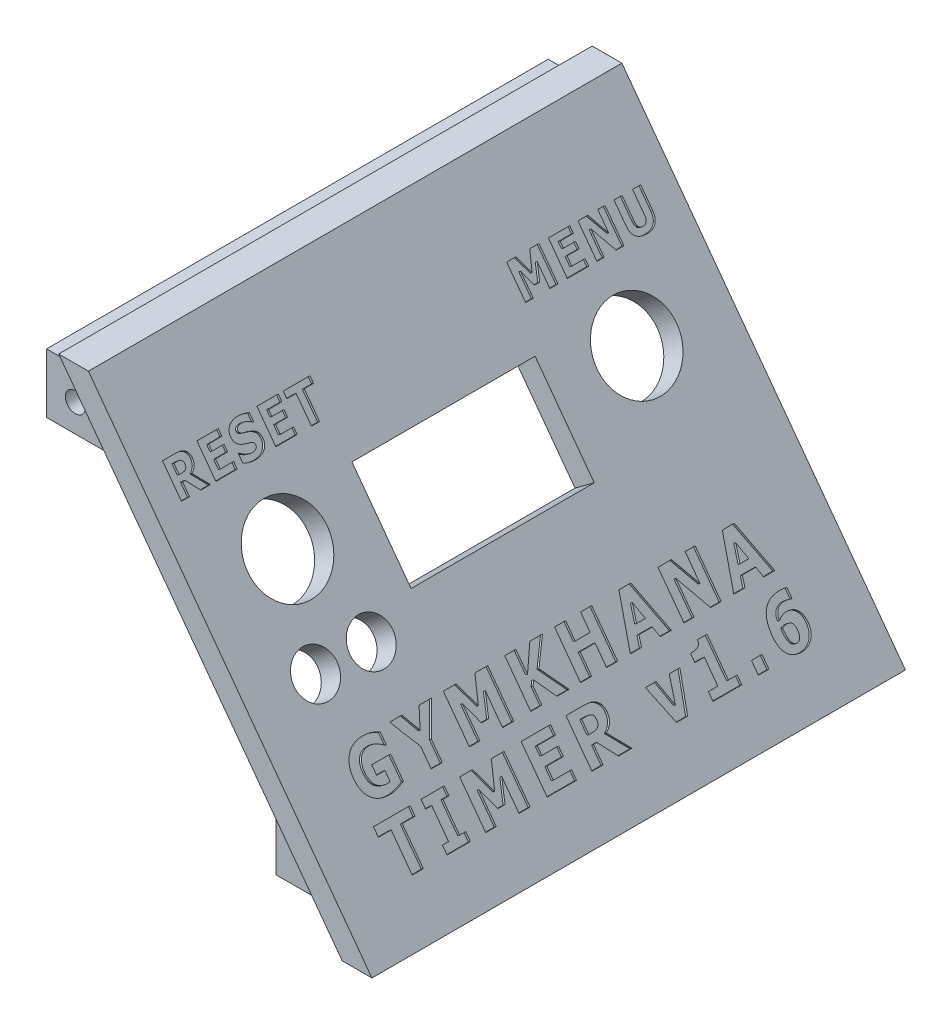
from build123d import *

# Parameters (mm, degrees)
DODANIE_WYCI_GNI_CIE1_DEPTH = 67
SZKIC2_R                    = 3.5
DODANIE_WYCI_GNI_CIE2_DEPTH = 5
SZKIC3_R                    = 1.25
WYTNIJ_WYCI_GNI_CIE1_DEPTH  = 4
SZKIC4_R                    = 5
SZKIC4_R_2                  = 2.7
SZKIC4_W                    = 23
SZKIC4_H                    = 12.5
WYTNIJ_WYCI_GNI_CIE3_DEPTH  = 10
DODANIE_WYCI_GNI_CIE5_DEPTH = 63
DODANIE_WYCI_GNI_CIE6_DEPTH = 10
DODANIE_WYCI_GNI_CIE7_DEPTH = 10
SZKIC10_R                   = 1.25
WYTNIJ_WYCI_GNI_CIE7_DEPTH  = 6
WYTNIJ_WYCI_GNI_CIE8_START  = 6
SZKIC11_R                   = 1.25
WYTNIJ_WYCI_GNI_CIE8_DEPTH  = 6
SZKIC13_R                   = 1.25
WYTNIJ_WYCI_GNI_CIE9_DEPTH  = 6
DODANIE_WYCI_GNI_CIE8_DEPTH = 2
DODANIE_WYCI_GNI_CIE9_DEPTH = 2
WYTNIJ_WYCI_GNI_CIE10_DEPTH = 0.3
SZKIC19_W                   = 1.32278481
SZKIC19_H                   = 1.462025316
WYTNIJ_WYCI_GNI_CIE11_DEPTH = 0.3


with BuildPart() as part:
    # Szkic1 → Dodanie-wyciągnięcie1 (new body)
    with BuildSketch(Plane.XY):
        Polygon((91.551497243, -16.631422451), (55.943641693, 31.568577549), (59.673493323, 31.568577549), (95.281348873, -16.631422451), align=None)
    extrude(amount=DODANIE_WYCI_GNI_CIE1_DEPTH)

    # Szkic2 → Dodanie-wyciągnięcie2 (add)
    with BuildSketch(Plane(origin=(51.279153453, 37.882586906, 0), x_dir=(0, 0, 1), z_dir=(-0.8043215381170195, -0.5941942976174309, 0))):
        with Locations(Location((7.562275383, -20.530690472, 0), (0, 0, 90))):
            Circle(SZKIC2_R)
        with Locations(Location((59.562275523, -20.530690472, 0), (0, 0, 90))):
            Circle(SZKIC2_R)
        with Locations(Location((7.562275383, -51.530691972, 0), (0, 0, 90))):
            Circle(SZKIC2_R)
        with Locations(Location((59.562275523, -51.530691972, 0), (0, 0, 90))):
            Circle(SZKIC2_R)
    extrude(amount=DODANIE_WYCI_GNI_CIE2_DEPTH)

    # Szkic3 → Wytnij-wyciągnięcie1 (cut)
    with BuildSketch(Plane(origin=(47.257545762, 34.911615418, 0), x_dir=(0, 0, 1), z_dir=(-0.8043215381170195, -0.5941942976174309, 0))):
        with Locations(Location((7.562275383, -20.530690472, 0), (0, 0, 270))):
            Circle(SZKIC3_R)
        with Locations(Location((59.562275523, -20.530690472, 0), (0, 0, 270))):
            Circle(SZKIC3_R)
        with Locations(Location((7.562275383, -51.530691972, 0), (0, 0, 270))):
            Circle(SZKIC3_R)
        with Locations(Location((59.562275523, -51.530691972, 0), (0, 0, 270))):
            Circle(SZKIC3_R)
    extrude(amount=-WYTNIJ_WYCI_GNI_CIE1_DEPTH, mode=Mode.SUBTRACT)

    # Szkic4 → Wytnij-wyciągnięcie3 (cut)
    with BuildSketch(Plane(origin=(53.692118067, 39.665169799, 0), x_dir=(0, 0, -1), z_dir=(0.8043215381170198, 0.5941942976174306, 0))):
        with Locations(Location((-55.528674361, -32.847153496, 0), (0, 0, 90))):
            Circle(SZKIC4_R)
        with Locations(Location((-11.595876087, -32.714230134, 0), (0, 0, 90))):
            Circle(SZKIC4_R)
        with Locations(Location((-58.537274149, -43.820748718, 0), (0, 0, 90))):
            Circle(SZKIC4_R_2)
        with Locations(Location((-51.537293222, -43.820729645, 0), (0, 0, 90))):
            Circle(SZKIC4_R_2)
        with Locations((-33.628276354, -35.210709885)):
            Rectangle(SZKIC4_W, SZKIC4_H)
    extrude(amount=-WYTNIJ_WYCI_GNI_CIE3_DEPTH, mode=Mode.SUBTRACT)

    # Szkic5 → Dodanie-wyciągnięcie5 (add)
    with BuildSketch(Plane.XY.offset(2)):
        Polygon((81.232481476, -9.431422451), (81.232481476, -13.431422451), (89.187490236, -13.431422451), (86.232481476, -9.431422451), align=None)
        Polygon((52.421146073, 29.368577549), (57.56889651, 29.368577549), (60.52390527, 25.368577549), (52.421146073, 25.368577549), align=None)
    extrude(amount=DODANIE_WYCI_GNI_CIE5_DEPTH)

    # Szkic8 → Dodanie-wyciągnięcie6 (add)
    with BuildSketch(Plane.XY.offset(2)):
        Polygon((52.421146073, 25.368577549), (52.421146073, 21.902199274), (63.084699811, 21.902199274), (60.52390527, 25.368577549), align=None)
        Polygon((81.232481476, -9.431422451), (86.232481476, -9.431422451), (83.978076817, -6.379783904), (82.475765353, -4.346204194), (81.232481476, -4.346204194), (81.232481476, -6.379783904), align=None)
    extrude(amount=DODANIE_WYCI_GNI_CIE6_DEPTH)

    # Szkic9 → Dodanie-wyciągnięcie7 (add)
    with BuildSketch(Plane(origin=(0, 0, 65), x_dir=(-1, 0, 0), z_dir=(0, 0, -1))):
        Polygon((-52.421146073, 21.902199274), (-52.421146073, 25.368577549), (-60.52390527, 25.368577549), (-63.084699811, 21.902199274), align=None)
        Polygon((-81.232481476, -9.431422451), (-81.232481476, -4.346204194), (-82.475765353, -4.346204194), (-86.232481476, -9.431422451), align=None)
    extrude(amount=DODANIE_WYCI_GNI_CIE7_DEPTH)

    # Szkic10 → Wytnij-wyciągnięcie7 (cut)
    with BuildSketch(Plane(origin=(0, 0, 65), x_dir=(-1, 0, 0), z_dir=(0, 0, -1))):
        with Locations(Location((-56.030137684, 25.368577549, 0), (0, 0, 90))):
            Circle(SZKIC10_R)
    extrude(amount=WYTNIJ_WYCI_GNI_CIE7_DEPTH, mode=Mode.SUBTRACT)

    # Szkic11 → Wytnij-wyciągnięcie8 (cut)
    with BuildSketch(Plane.XY.offset(2).offset(WYTNIJ_WYCI_GNI_CIE8_START)):
        with Locations(Location((56.030137684, 25.368577549, 0), (0, 0, 90))):
            Circle(SZKIC11_R)
    extrude(amount=-WYTNIJ_WYCI_GNI_CIE8_DEPTH, mode=Mode.SUBTRACT)

    # Szkic13 → Wytnij-wyciągnięcie9 (cut)
    with BuildSketch(Plane(origin=(0, -13.631422451, 0), x_dir=(-1, 0, 0), z_dir=(0, -1, 0))):
        with Locations(Location((-83.732481476, -5, 0), (0, 0, 90))):
            Circle(SZKIC13_R)
        with Locations(Location((-83.732481476, -62, 0), (0, 0, 90))):
            Circle(SZKIC13_R)
    extrude(amount=-WYTNIJ_WYCI_GNI_CIE9_DEPTH, mode=Mode.SUBTRACT)

    # Szkic16 → Dodanie-wyciągnięcie8 (add)
    with BuildSketch(Plane(origin=(0, 0, 65), x_dir=(-1, 0, 0), z_dir=(0, 0, -1))):
        Polygon((-82.475765353, -4.346204194), (-81.232481476, -4.346204194), (-61.841415934, 21.902199274), (-63.084699811, 21.902199274), align=None)
    extrude(amount=DODANIE_WYCI_GNI_CIE8_DEPTH)

    # Szkic17 → Dodanie-wyciągnięcie9 (add)
    with BuildSketch(Plane.XY.offset(2)):
        Polygon((61.841415934, 21.902199274), (63.084699811, 21.902199274), (82.475765353, -4.346204194), (81.232481476, -4.346204194), align=None)
    extrude(amount=DODANIE_WYCI_GNI_CIE9_DEPTH)

    # Szkic18 → Wytnij-wyciągnięcie10 (cut)
    # profile 1 of 9: a face of its own
    with BuildSketch(Plane(origin=(53.692118067, 39.665169799, 0), x_dir=(0, 0, -1), z_dir=(0.8043215381170198, 0.5941942976174306, 0))):
        with BuildLine():
            Line((-60.169025405, -24.364973838), (-61.389753253, -24.364973838))
            Line((-61.389753253, -24.364973838), (-62.488645658, -22.896619408))
            Line((-62.488645658, -22.896619408), (-62.801936797, -22.896619408))
            Line((-62.801936797, -22.896619408), (-62.801936797, -24.364973838))
            Line((-62.801936797, -24.364973838), (-63.814595025, -24.364973838))
            Line((-63.814595025, -24.364973838), (-63.814595025, -20.364973838))
            Line((-63.814595025, -20.364973838), (-62.218076038, -20.364973838))
            add(Edge.make_bspline(
                [(-62.218076038, -20.364973838), (-62.164796445, -20.365343537), (-62.061865282, -20.36605776), (-61.912718993, -20.373938315), (-61.774180392, -20.387502755), (-61.644801312, -20.405072534), (-61.522500945, -20.430564335), (-61.406489512, -20.469439473), (-61.294360342, -20.517668573), (-61.224518514, -20.559330975), (-61.189595025, -20.580163712)],
                knots=[0, 0, 0, 0, 1.199793894, 2.317889013, 3.362092139, 4.333845176, 5.257590495, 6.170331022, 7.085098041, 8, 8, 8, 8], degree=3))
            add(Edge.make_bspline(
                [(-61.189595025, -20.580163712), (-61.155171977, -20.603565792), (-61.087212134, -20.649767442), (-60.997458333, -20.733702774), (-60.91767859, -20.825700418), (-60.849010772, -20.927853406), (-60.791886119, -21.041396579), (-60.754173705, -21.170254033), (-60.729979722, -21.312371846), (-60.72735241, -21.412069745), (-60.72598743, -21.463866244)],
                knots=[0, 0, 0, 0, 0.953924463, 1.883289238, 2.810108911, 3.743307755, 4.701369409, 5.714009315, 6.812348952, 8, 8, 8, 8], degree=3))
            add(Edge.make_bspline(
                [(-60.72598743, -21.463866244), (-60.726464911, -21.501344225), (-60.727398254, -21.574603309), (-60.738473162, -21.681525203), (-60.753553708, -21.783214654), (-60.776628975, -21.879556045), (-60.806732274, -21.970136575), (-60.842348621, -22.05589459), (-60.885102475, -22.13585551), (-60.950991436, -22.234950432), (-61.046284525, -22.349189887), (-61.179093354, -22.470570768), (-61.32850617, -22.579192397), (-61.43928278, -22.636424873), (-61.495765911, -22.66560675)],
                knots=[0, 0, 0, 0, 0.888936574, 1.737625011, 2.548320823, 3.326937543, 4.084834997, 4.811205944, 5.527889522, 6.232533624, 7.632244915, 9.044932759, 10.493260882, 12, 12, 12, 12], degree=3))
            Line((-61.495765911, -22.66560675), (-60.169025405, -24.364973838))
        make_face()
        with BuildLine():
            add(Edge.make_bspline(
                [(-61.738645658, -21.579372573), (-61.739037975, -21.554261975), (-61.739797947, -21.505619365), (-61.751804553, -21.435507201), (-61.768154135, -21.370184023), (-61.794264471, -21.311122554), (-61.826416091, -21.256504575), (-61.870006825, -21.209842628), (-61.92266222, -21.169133921), (-61.962932551, -21.148605011), (-61.983898823, -21.137916876)],
                knots=[0, 0, 0, 0, 1.119761289, 2.169128442, 3.168954851, 4.118408773, 5.043447249, 5.985348535, 6.951095516, 8, 8, 8, 8], degree=3))
            add(Edge.make_bspline(
                [(-61.983898823, -21.137916876), (-62.016265628, -21.125434016), (-62.08293326, -21.099722403), (-62.173845648, -21.085413518), (-62.252582417, -21.080022193), (-62.319545142, -21.075435683), (-62.393444683, -21.074574563), (-62.445134323, -21.07408786), (-62.472031734, -21.073834598)],
                knots=[0, 0, 0, 0, 1.256441546, 2.587959541, 3.317795867, 4.123378269, 5.023474215, 6, 6, 6, 6], degree=3))
            Line((-62.472031734, -21.073834598), (-62.801936797, -21.073834598))
            Line((-62.801936797, -21.073834598), (-62.801936797, -22.187758649))
            Line((-62.801936797, -22.187758649), (-62.519500088, -22.187758649))
            add(Edge.make_bspline(
                [(-62.519500088, -22.187758649), (-62.486533226, -22.187449017), (-62.423199484, -22.186854175), (-62.331806917, -22.182513883), (-62.248497023, -22.173346564), (-62.171770563, -22.163234441), (-62.101737636, -22.146111603), (-62.037627322, -22.12103201), (-61.978083612, -22.089907099), (-61.943422576, -22.062285986), (-61.926145658, -22.048518142)],
                knots=[0, 0, 0, 0, 1.270824428, 2.441423287, 3.524730841, 4.500863784, 5.422940595, 6.295084937, 7.15017896, 8, 8, 8, 8], degree=3))
            add(Edge.make_bspline(
                [(-61.926145658, -22.048518142), (-61.911028424, -22.035430365), (-61.880909019, -22.009354426), (-61.842401265, -21.964286582), (-61.810377352, -21.915166077), (-61.783663774, -21.861984358), (-61.762789493, -21.802539837), (-61.749089508, -21.735218512), (-61.740405919, -21.660031551), (-61.739250528, -21.607089038), (-61.738645658, -21.579372573)],
                knots=[0, 0, 0, 0, 0.914359853, 1.821760216, 2.702345359, 3.593131941, 4.539985656, 5.57704332, 6.731533712, 8, 8, 8, 8], degree=3))
        make_face(mode=Mode.SUBTRACT)
    # profile 2 of 9: a face of its own
    with BuildSketch(Plane(origin=(53.692118067, 39.665169799, 0), x_dir=(0, 0, -1), z_dir=(0.8043215381170198, 0.5941942976174306, 0))):
        Polygon((-59.490544392, -24.364973838), (-59.490544392, -20.364973838), (-56.807000088, -20.364973838), (-56.807000088, -21.124467509), (-58.477886164, -21.124467509), (-58.477886164, -21.833328269), (-56.958898823, -21.833328269), (-56.958898823, -22.59282194), (-58.477886164, -22.59282194), (-58.477886164, -23.605480168), (-56.807000088, -23.605480168), (-56.807000088, -24.364973838), align=None)
    # profile 3 of 9: a face of its own
    with BuildSketch(Plane(origin=(53.692118067, 39.665169799, 0), x_dir=(0, 0, -1), z_dir=(0.8043215381170198, 0.5941942976174306, 0))):
        with BuildLine():
            add(Edge.make_bspline(
                [(-54.546240595, -24.466239661), (-54.619324689, -24.465259645), (-54.760946104, -24.463360581), (-54.966738016, -24.446377486), (-55.159011531, -24.419517885), (-55.338701793, -24.379959251), (-55.5077699, -24.331836275), (-55.669767454, -24.278200727), (-55.826332659, -24.221600191), (-55.926991508, -24.177738597), (-55.976620342, -24.156113079)],
                knots=[0, 0, 0, 0, 1.188587951, 2.303230391, 3.356350567, 4.344124042, 5.293358606, 6.214416522, 7.119636025, 8, 8, 8, 8], degree=3))
            Line((-55.976620342, -24.156113079), (-55.976620342, -23.200416876))
            Line((-55.976620342, -23.200416876), (-55.886430468, -23.200416876))
            add(Edge.make_bspline(
                [(-55.886430468, -23.200416876), (-55.836550026, -23.243561879), (-55.737782442, -23.328992709), (-55.577269894, -23.439730554), (-55.410245133, -23.53604222), (-55.2365475, -23.615352917), (-55.060941782, -23.678850013), (-54.885624169, -23.722675364), (-54.713409345, -23.752665903), (-54.598840578, -23.755821282), (-54.542284899, -23.757378902)],
                knots=[0, 0, 0, 0, 1.064005933, 2.106823643, 3.142324773, 4.172904671, 5.185521809, 6.151983196, 7.087745727, 8, 8, 8, 8], degree=3))
            add(Edge.make_bspline(
                [(-54.542284899, -23.757378902), (-54.526983101, -23.756983588), (-54.49422939, -23.756137415), (-54.441730693, -23.751858927), (-54.382652622, -23.745456989), (-54.318689757, -23.737273446), (-54.25472317, -23.725958525), (-54.195134285, -23.711983433), (-54.142400456, -23.69510788), (-54.110973441, -23.679922363), (-54.096082367, -23.672727003)],
                knots=[0, 0, 0, 0, 0.803171281, 1.719199296, 2.763054104, 3.921781135, 5.102693432, 6.170135007, 7.132954358, 8, 8, 8, 8], degree=3))
            add(Edge.make_bspline(
                [(-54.096082367, -23.672727003), (-54.079260425, -23.663855653), (-54.045859583, -23.646241124), (-53.999763548, -23.6136797), (-53.958507287, -23.575634944), (-53.919660884, -23.534440713), (-53.888545071, -23.485187085), (-53.864961384, -23.429268786), (-53.852961415, -23.36546938), (-53.85104133, -23.320975551), (-53.850038063, -23.297727003)],
                knots=[0, 0, 0, 0, 0.958250464, 1.902656275, 2.834625234, 3.785374419, 4.748042504, 5.755488648, 6.827216455, 8, 8, 8, 8], degree=3))
            add(Edge.make_bspline(
                [(-53.850038063, -23.297727003), (-53.851255739, -23.273288679), (-53.853627288, -23.225692519), (-53.87663667, -23.158123931), (-53.915383975, -23.098857187), (-53.967423904, -23.047696814), (-54.029493373, -23.005003057), (-54.095971968, -22.964734274), (-54.170111354, -22.934782493), (-54.22175592, -22.918916624), (-54.247981101, -22.910859914)],
                knots=[0, 0, 0, 0, 0.976980105, 1.90276968, 2.820378867, 3.79191295, 4.806747273, 5.83454199, 6.900377446, 8, 8, 8, 8], degree=3))
            add(Edge.make_bspline(
                [(-54.247981101, -22.910859914), (-54.318023295, -22.892735796), (-54.462151853, -22.855441089), (-54.682439919, -22.807723559), (-54.902565623, -22.756915502), (-55.044419675, -22.710404522), (-55.11348743, -22.687758649)],
                knots=[0, 0, 0, 0, 0.970778871, 1.997609583, 3.025049981, 4, 4, 4, 4], degree=3))
            add(Edge.make_bspline(
                [(-55.11348743, -22.687758649), (-55.150844706, -22.673680369), (-55.22344015, -22.646322407), (-55.326938441, -22.599160319), (-55.422345002, -22.549191552), (-55.50947787, -22.494787197), (-55.588504666, -22.437427678), (-55.659648406, -22.376214212), (-55.722135542, -22.311115885), (-55.777779388, -22.242802284), (-55.823987651, -22.16902792), (-55.865766067, -22.092562064), (-55.899635173, -22.010675209), (-55.928394331, -21.924908974), (-55.949192938, -21.83416332), (-55.965298795, -21.73965125), (-55.974879408, -21.640487586), (-55.976031818, -21.572800424), (-55.976620342, -21.538233332)],
                knots=[0, 0, 0, 0, 1.232734205, 2.395541005, 3.510463934, 4.556875624, 5.565319495, 6.523880384, 7.451310254, 8.349375782, 9.239576409, 10.136015274, 11.0376197, 11.972601359, 12.926826808, 13.909683999, 14.932498543, 16, 16, 16, 16], degree=3))
            add(Edge.make_bspline(
                [(-55.976620342, -21.538233332), (-55.975361565, -21.491992579), (-55.972886395, -21.401068053), (-55.950069685, -21.267954088), (-55.912837831, -21.141579008), (-55.861221323, -21.021738504), (-55.793862573, -20.909248282), (-55.711863704, -20.803732906), (-55.615108512, -20.704920211), (-55.504609443, -20.614153184), (-55.383663346, -20.531187225), (-55.253193973, -20.460502207), (-55.116493881, -20.398842542), (-54.972212609, -20.348972041), (-54.820102147, -20.311331533), (-54.6612385, -20.283757899), (-54.494923941, -20.266710201), (-54.381724821, -20.264722729), (-54.323930468, -20.263708016)],
                knots=[0, 0, 0, 0, 0.951733787, 1.8714216, 2.771937187, 3.659834458, 4.551246461, 5.464900409, 6.405895824, 7.393377429, 8.405714223, 9.421759516, 10.445282372, 11.49132611, 12.560961497, 13.669079994, 14.809937645, 16, 16, 16, 16], degree=3))
            add(Edge.make_bspline(
                [(-54.323930468, -20.263708016), (-54.264833186, -20.264678032), (-54.146489923, -20.266620504), (-53.969594869, -20.280570168), (-53.793133795, -20.302429913), (-53.619051722, -20.334332079), (-53.449228603, -20.372525307), (-53.287089853, -20.417569793), (-53.133858439, -20.468340458), (-53.036783419, -20.508894194), (-52.98927857, -20.528739661)],
                knots=[0, 0, 0, 0, 1.035526462, 2.073658467, 3.107699001, 4.15013179, 5.173679131, 6.156969703, 7.09809057, 8, 8, 8, 8], degree=3))
            Line((-52.98927857, -20.528739661), (-52.98927857, -21.428264978))
            Line((-52.98927857, -21.428264978), (-53.077886164, -21.428264978))
            add(Edge.make_bspline(
                [(-53.077886164, -21.428264978), (-53.116369058, -21.396934014), (-53.194926254, -21.332976436), (-53.325713374, -21.249191114), (-53.467663404, -21.171150034), (-53.620283402, -21.102695183), (-53.779717534, -21.04409924), (-53.943980471, -21.003723513), (-54.110215356, -20.97663413), (-54.222030988, -20.973925599), (-54.278044392, -20.972568775)],
                knots=[0, 0, 0, 0, 0.909132475, 1.855860894, 2.842486714, 3.876811078, 4.919788485, 5.951669293, 6.973900401, 8, 8, 8, 8], degree=3))
            add(Edge.make_bspline(
                [(-54.278044392, -20.972568775), (-54.319499997, -20.973280404), (-54.398531673, -20.974637065), (-54.513725264, -20.990566743), (-54.625504311, -21.0216608), (-54.696444696, -21.054301039), (-54.733740595, -21.07146118)],
                knots=[0, 0, 0, 0, 1.055808145, 2.01281076, 2.955263502, 4, 4, 4, 4], degree=3))
            add(Edge.make_bspline(
                [(-54.733740595, -21.07146118), (-54.749010424, -21.079784416), (-54.779674534, -21.096498724), (-54.822016152, -21.128965296), (-54.861237119, -21.166696944), (-54.896885615, -21.209387006), (-54.927317375, -21.255864098), (-54.947541684, -21.307131995), (-54.962224017, -21.360198172), (-54.963379829, -21.397044183), (-54.963962114, -21.41560675)],
                knots=[0, 0, 0, 0, 0.957416142, 1.922635494, 2.930164298, 3.951958416, 4.984347753, 5.975062963, 6.979861616, 8, 8, 8, 8], degree=3))
            add(Edge.make_bspline(
                [(-54.963962114, -21.41560675), (-54.962569202, -21.440262215), (-54.959884024, -21.487791657), (-54.939862729, -21.555544325), (-54.904700166, -21.614585859), (-54.864615289, -21.656932587), (-54.824340542, -21.686010458), (-54.787923211, -21.70812959), (-54.74480898, -21.729600347), (-54.695215156, -21.749292166), (-54.640158505, -21.77058578), (-54.578496913, -21.789948018), (-54.510326949, -21.808821305), (-54.462671056, -21.820774563), (-54.437854519, -21.826999155)],
                knots=[0, 0, 0, 0, 1.214264784, 2.34079248, 3.441844924, 4.572488008, 5.185916398, 5.885766898, 6.670379076, 7.556104553, 8.514370256, 9.57884454, 10.739196989, 12, 12, 12, 12], degree=3))
            add(Edge.make_bspline(
                [(-54.437854519, -21.826999155), (-54.372164623, -21.84193036), (-54.243289013, -21.871223573), (-54.050165256, -21.916962088), (-53.85328916, -21.967452646), (-53.722621592, -22.012966964), (-53.654626671, -22.036651054)],
                knots=[0, 0, 0, 0, 0.996266869, 1.954554799, 2.935620461, 4, 4, 4, 4], degree=3))
            add(Edge.make_bspline(
                [(-53.654626671, -22.036651054), (-53.620935175, -22.049363765), (-53.555107254, -22.074202417), (-53.461940498, -22.118565733), (-53.374317577, -22.16371559), (-53.294299626, -22.21401985), (-53.220472184, -22.267002148), (-53.152967873, -22.322983891), (-53.09262252, -22.38275947), (-53.038035101, -22.445544305), (-52.990501444, -22.513210521), (-52.94896877, -22.585309751), (-52.915106453, -22.663026432), (-52.886385201, -22.745447977), (-52.864481284, -22.833395864), (-52.84871767, -22.92648242), (-52.8391084, -23.024581531), (-52.837964235, -23.091745042), (-52.837379835, -23.126049788)],
                knots=[0, 0, 0, 0, 1.17454689, 2.294881178, 3.365011102, 4.38938974, 5.375760562, 6.328835541, 7.247690706, 8.144686596, 9.040029798, 9.941965584, 10.855040075, 11.802113214, 12.787244475, 13.808691087, 14.880756899, 16, 16, 16, 16], degree=3))
            add(Edge.make_bspline(
                [(-52.837379835, -23.126049788), (-52.838704625, -23.175177416), (-52.841303196, -23.27154106), (-52.863016499, -23.412545081), (-52.899379335, -23.546068511), (-52.950415508, -23.672212932), (-53.015844527, -23.79083342), (-53.095295659, -23.90249798), (-53.190572419, -24.005587855), (-53.298767613, -24.100948628), (-53.418846637, -24.187262957), (-53.550356694, -24.261747127), (-53.691662028, -24.324910189), (-53.842929249, -24.377564465), (-54.004536893, -24.417520657), (-54.176256603, -24.445525745), (-54.357830198, -24.463500312), (-54.482377867, -24.465311144), (-54.546240595, -24.466239661)],
                knots=[0, 0, 0, 0, 0.965575501, 1.893972421, 2.797150248, 3.681070906, 4.56293602, 5.455031491, 6.368877871, 7.316649527, 8.286503653, 9.271159268, 10.283057314, 11.32599161, 12.416327018, 13.55177918, 14.744656859, 16, 16, 16, 16], degree=3))
        make_face()
    # profile 4 of 9: a face of its own
    with BuildSketch(Plane(origin=(53.692118067, 39.665169799, 0), x_dir=(0, 0, -1), z_dir=(0.8043215381170198, 0.5941942976174306, 0))):
        Polygon((-51.956367177, -24.364973838), (-51.956367177, -20.364973838), (-49.272822873, -20.364973838), (-49.272822873, -21.124467509), (-50.943708949, -21.124467509), (-50.943708949, -21.833328269), (-49.424721607, -21.833328269), (-49.424721607, -22.59282194), (-50.943708949, -22.59282194), (-50.943708949, -23.605480168), (-49.272822873, -23.605480168), (-49.272822873, -24.364973838), align=None)
    # profile 5 of 9: a face of its own
    with BuildSketch(Plane(origin=(53.692118067, 39.665169799, 0), x_dir=(0, 0, -1), z_dir=(0.8043215381170198, 0.5941942976174306, 0))):
        Polygon((-47.48041781, -24.364973838), (-47.48041781, -21.124467509), (-48.644974772, -21.124467509), (-48.644974772, -20.364973838), (-45.30320262, -20.364973838), (-45.30320262, -21.124467509), (-46.467759582, -21.124467509), (-46.467759582, -24.364973838), align=None)
    # profile 6 of 9: a face of its own
    with BuildSketch(Plane(origin=(53.692118067, 39.665169799, 0), x_dir=(0, 0, -1), z_dir=(0.8043215381170198, 0.5941942976174306, 0))):
        Polygon((-16.533582367, -24.364973838), (-17.546240595, -24.364973838), (-17.546240595, -21.703581433), (-18.251936797, -23.402948522), (-18.916493759, -23.402948522), (-19.622189962, -21.703581433), (-19.622189962, -24.364973838), (-20.584215278, -24.364973838), (-20.584215278, -20.364973838), (-19.416493759, -20.364973838), (-18.556525405, -22.325416876), (-17.699721607, -20.364973838), (-16.533582367, -20.364973838), align=None)
    # profile 7 of 9: a face of its own
    with BuildSketch(Plane(origin=(53.692118067, 39.665169799, 0), x_dir=(0, 0, -1), z_dir=(0.8043215381170198, 0.5941942976174306, 0))):
        Polygon((-15.34877224, -24.364973838), (-15.34877224, -20.364973838), (-12.665227937, -20.364973838), (-12.665227937, -21.124467509), (-14.336114013, -21.124467509), (-14.336114013, -21.833328269), (-12.817126671, -21.833328269), (-12.817126671, -22.59282194), (-14.336114013, -22.59282194), (-14.336114013, -23.605480168), (-12.665227937, -23.605480168), (-12.665227937, -24.364973838), align=None)
    # profile 8 of 9: a face of its own
    with BuildSketch(Plane(origin=(53.692118067, 39.665169799, 0), x_dir=(0, 0, -1), z_dir=(0.8043215381170198, 0.5941942976174306, 0))):
        Polygon((-8.239911481, -24.364973838), (-9.19877224, -24.364973838), (-10.720924139, -21.576208016), (-10.720924139, -24.364973838), (-11.632316544, -24.364973838), (-11.632316544, -20.364973838), (-10.410797557, -20.364973838), (-9.151303886, -22.656113079), (-9.151303886, -20.364973838), (-8.239911481, -20.364973838), align=None)
    # profile 9 of 9: a face of its own
    with BuildSketch(Plane(origin=(53.692118067, 39.665169799, 0), x_dir=(0, 0, -1), z_dir=(0.8043215381170198, 0.5941942976174306, 0))):
        with BuildLine():
            add(Edge.make_bspline(
                [(-5.436430468, -24.466239661), (-5.501616005, -24.465053267), (-5.62829634, -24.462747652), (-5.812285887, -24.444124477), (-5.985109328, -24.415023333), (-6.145760899, -24.370936711), (-6.295717592, -24.317039693), (-6.433340168, -24.249104481), (-6.560140863, -24.170070699), (-6.674576077, -24.077852651), (-6.776336274, -23.973791005), (-6.865053643, -23.858119591), (-6.939295046, -23.730814208), (-7.000796499, -23.592667471), (-7.048053798, -23.442940419), (-7.081830389, -23.282113616), (-7.101543383, -23.109924726), (-7.104309083, -22.991607832), (-7.105734266, -22.930638395)],
                knots=[0, 0, 0, 0, 1.20889921, 2.349351777, 3.427017415, 4.455847307, 5.435483287, 6.378388974, 7.297220547, 8.201760428, 9.097701332, 9.990980776, 10.898742395, 11.825056972, 12.790409071, 13.805470659, 14.869145272, 16, 16, 16, 16], degree=3))
            Line((-7.105734266, -22.930638395), (-7.105734266, -20.364973838))
            Line((-7.105734266, -20.364973838), (-6.093076038, -20.364973838))
            Line((-6.093076038, -20.364973838), (-6.093076038, -22.876840927))
            add(Edge.make_bspline(
                [(-6.093076038, -22.876840927), (-6.092662498, -22.910612268), (-6.091860281, -22.976124445), (-6.084490807, -23.071178296), (-6.073475575, -23.159648686), (-6.055211672, -23.241040662), (-6.034941679, -23.316426096), (-6.00732396, -23.38458193), (-5.977135831, -23.447049264), (-5.940162001, -23.502166847), (-5.898284408, -23.550987988), (-5.849718625, -23.592586562), (-5.796036048, -23.628499708), (-5.735525234, -23.656803555), (-5.66971119, -23.680190038), (-5.597074618, -23.69543209), (-5.518708689, -23.705091561), (-5.464415028, -23.706183284), (-5.436430468, -23.70674599)],
                knots=[0, 0, 0, 0, 1.331165497, 2.582294552, 3.757141455, 4.84200943, 5.868829169, 6.830301252, 7.736977925, 8.599166662, 9.439321676, 10.264810001, 11.11258577, 11.97752831, 12.891625934, 13.860322391, 14.897146833, 16, 16, 16, 16], degree=3))
            add(Edge.make_bspline(
                [(-5.436430468, -23.70674599), (-5.408971187, -23.706200395), (-5.355724674, -23.705142426), (-5.278753411, -23.695239345), (-5.207095563, -23.680634475), (-5.141142888, -23.659433084), (-5.08110186, -23.631491231), (-5.026744534, -23.597313079), (-4.978367474, -23.556573829), (-4.934773243, -23.510218905), (-4.89734068, -23.456219297), (-4.865085205, -23.394988655), (-4.837510946, -23.326544129), (-4.814434133, -23.250914658), (-4.797264093, -23.167735705), (-4.78613092, -23.077223996), (-4.777536526, -22.979586983), (-4.776933286, -22.911936259), (-4.776620342, -22.876840927)],
                knots=[0, 0, 0, 0, 1.079206003, 2.092697049, 3.046504859, 3.951550563, 4.809764005, 5.644026712, 6.468501297, 7.290232633, 8.138870875, 9.04344124, 10.006225207, 11.036185737, 12.148605823, 13.340896587, 14.620530438, 16, 16, 16, 16], degree=3))
            Line((-4.776620342, -22.876840927), (-4.776620342, -20.364973838))
            Line((-4.776620342, -20.364973838), (-3.763962114, -20.364973838))
            Line((-3.763962114, -20.364973838), (-3.763962114, -22.928264978))
            add(Edge.make_bspline(
                [(-3.763962114, -22.928264978), (-3.765052705, -22.988446251), (-3.767173247, -23.10546262), (-3.787154666, -23.275481796), (-3.820463039, -23.434540291), (-3.865788611, -23.58371409), (-3.926318526, -23.721298842), (-3.998512349, -23.849072881), (-4.085628097, -23.964811295), (-4.184667973, -24.070633838), (-4.296988923, -24.164912094), (-4.42303434, -24.245236533), (-4.560514349, -24.314874132), (-4.711595303, -24.369854612), (-4.875024953, -24.413049179), (-5.050907414, -24.444684834), (-5.239588994, -24.462635062), (-5.369408963, -24.46501235), (-5.436430468, -24.466239661)],
                knots=[0, 0, 0, 0, 1.112985887, 2.164087931, 3.161073054, 4.116228462, 5.042529852, 5.936270584, 6.825138138, 7.715570683, 8.612541069, 9.530013209, 10.474708362, 11.457956063, 12.498132776, 13.598602899, 14.760242755, 16, 16, 16, 16], degree=3))
        make_face()
    extrude(amount=-WYTNIJ_WYCI_GNI_CIE10_DEPTH, mode=Mode.SUBTRACT)

    # Szkic19 → Wytnij-wyciągnięcie11 (cut)
    # profile 1 of 17: a face of its own
    with BuildSketch(Plane(origin=(53.692118067, 39.665169799, 0), x_dir=(0, 0, -1), z_dir=(0.8043215381170198, 0.5941942976174306, 0))):
        with BuildLine():
            add(Edge.make_bspline(
                [(-54.801195527, -56.104650036), (-54.864424518, -56.12956852), (-54.998397594, -56.182367177), (-55.215690134, -56.2527662), (-55.458570344, -56.324724355), (-55.722943362, -56.394571757), (-55.999624509, -56.454876436), (-56.279084451, -56.500204363), (-56.556764434, -56.526961069), (-56.741441956, -56.530435115), (-56.833236666, -56.532161903)],
                knots=[0, 0, 0, 0, 0.780989599, 1.654803845, 2.624071041, 3.692593391, 4.796992972, 5.877542457, 6.945023884, 8, 8, 8, 8], degree=3))
            add(Edge.make_bspline(
                [(-56.833236666, -56.532161903), (-56.936313813, -56.529875536), (-57.137278484, -56.525417911), (-57.431222141, -56.490311091), (-57.708720381, -56.430814645), (-57.970603053, -56.347655732), (-58.216681175, -56.242708773), (-58.445886604, -56.111451233), (-58.660007048, -55.958193736), (-58.856029614, -55.780165997), (-59.032661377, -55.580969849), (-59.186944867, -55.361070371), (-59.316943392, -55.121174759), (-59.422541433, -54.86123575), (-59.504991034, -54.582102939), (-59.563344592, -54.283116188), (-59.598290183, -53.964660827), (-59.602718526, -53.745629237), (-59.604992995, -53.633131049)],
                knots=[0, 0, 0, 0, 1.087868783, 2.120966666, 3.119463563, 4.079411369, 5.017256861, 5.937821536, 6.861999817, 7.79148942, 8.726980861, 9.666761473, 10.620776839, 11.600970159, 12.623118583, 13.688314141, 14.812680534, 16, 16, 16, 16], degree=3))
            add(Edge.make_bspline(
                [(-59.604992995, -53.633131049), (-59.602693058, -53.526795734), (-59.598205858, -53.319334464), (-59.563269292, -53.015971787), (-59.503426519, -52.729173364), (-59.420716085, -52.458138224), (-59.315453748, -52.20263776), (-59.183796705, -51.964735983), (-59.02983166, -51.7422536), (-58.8522343, -51.537980445), (-58.655066518, -51.353327832), (-58.439180121, -51.191601635), (-58.204638145, -51.056594787), (-57.953490665, -50.945165981), (-57.684593284, -50.859121306), (-57.39900803, -50.797675324), (-57.095692841, -50.75981323), (-56.887740959, -50.755760648), (-56.781021476, -50.753680891)],
                knots=[0, 0, 0, 0, 1.119655006, 2.184458187, 3.210491154, 4.200989499, 5.16476007, 6.115015289, 7.05884974, 8.009020555, 8.96004274, 9.898671669, 10.843139352, 11.803924629, 12.786930566, 13.810822368, 14.876529016, 16, 16, 16, 16], degree=3))
            add(Edge.make_bspline(
                [(-56.781021476, -50.753680891), (-56.725905642, -50.754230561), (-56.618185507, -50.755304853), (-56.460295778, -50.759827868), (-56.310646136, -50.771920837), (-56.168546221, -50.783539911), (-56.03483854, -50.802891862), (-55.908744078, -50.823935509), (-55.790696854, -50.849966107), (-55.643195896, -50.891635092), (-55.462004418, -50.950891134), (-55.244272456, -51.032627242), (-55.023153782, -51.126481363), (-54.876024659, -51.195917463), (-54.801195527, -51.231232315)],
                knots=[0, 0, 0, 0, 0.96377752, 1.883637369, 2.760864299, 3.588580347, 4.375824843, 5.122126748, 5.823559954, 6.488060961, 7.801317481, 9.155561891, 10.553333086, 12, 12, 12, 12], degree=3))
            Line((-54.801195527, -51.231232315), (-54.801195527, -52.49418722))
            Line((-54.801195527, -52.49418722), (-54.925206603, -52.49418722))
            add(Edge.make_bspline(
                [(-54.925206603, -52.49418722), (-54.943367853, -52.481175926), (-54.983461228, -52.452451765), (-55.04793572, -52.404721686), (-55.123679324, -52.349898315), (-55.237239928, -52.269216541), (-55.381389141, -52.167248125), (-55.504394007, -52.098678511), (-55.563754862, -52.065587536)],
                knots=[0, 0, 0, 0, 0.522454513, 1.153387776, 1.875963891, 2.708928475, 4.411763488, 6, 6, 6, 6], degree=3))
            add(Edge.make_bspline(
                [(-55.563754862, -52.065587536), (-55.598700475, -52.047348008), (-55.670380489, -52.00993531), (-55.784813591, -51.961647448), (-55.907007995, -51.917321444), (-56.03550004, -51.875835202), (-56.169974255, -51.840660158), (-56.309569929, -51.815492337), (-56.453308072, -51.801649403), (-56.550376873, -51.799213702), (-56.599356128, -51.797984688)],
                knots=[0, 0, 0, 0, 0.875569801, 1.795958083, 2.756888549, 3.763351312, 4.795132841, 5.842927426, 6.91157813, 8, 8, 8, 8], degree=3))
            add(Edge.make_bspline(
                [(-56.599356128, -51.797984688), (-56.656367399, -51.79897946), (-56.768289992, -51.800932363), (-56.931632371, -51.823903331), (-57.087866927, -51.858025432), (-57.235794361, -51.908352311), (-57.376567697, -51.97263025), (-57.508423465, -52.053399794), (-57.635287893, -52.146088318), (-57.710185584, -52.220481602), (-57.748090305, -52.258131049)],
                knots=[0, 0, 0, 0, 1.07376491, 2.10797884, 3.102783072, 4.083972158, 5.047217519, 6.013005229, 6.994408504, 8, 8, 8, 8], degree=3))
            add(Edge.make_bspline(
                [(-57.748090305, -52.258131049), (-57.782796791, -52.297613553), (-57.853464772, -52.378006276), (-57.94282718, -52.515550011), (-58.022954431, -52.666817043), (-58.091303628, -52.833102558), (-58.14573511, -53.014494686), (-58.184251243, -53.210107478), (-58.208871722, -53.419653765), (-58.211324845, -53.564163564), (-58.212587932, -53.638570131)],
                knots=[0, 0, 0, 0, 0.845135156, 1.72083099, 2.631963299, 3.597631237, 4.609426272, 5.675016454, 6.802890564, 8, 8, 8, 8], degree=3))
            add(Edge.make_bspline(
                [(-58.212587932, -53.638570131), (-58.211135473, -53.718031431), (-58.208330844, -53.871467472), (-58.186595525, -54.093720433), (-58.150019278, -54.299683567), (-58.098879486, -54.490117611), (-58.034525004, -54.665041646), (-57.953194804, -54.823405417), (-57.857359504, -54.965710691), (-57.746474197, -55.091674941), (-57.623045073, -55.201905291), (-57.488237624, -55.296581432), (-57.343736542, -55.378522543), (-57.187126509, -55.442553563), (-57.021326016, -55.496178211), (-56.843819016, -55.530785122), (-56.656137873, -55.553217616), (-56.527266794, -55.556034392), (-56.461203438, -55.557478359)],
                knots=[0, 0, 0, 0, 1.285666435, 2.482561544, 3.609344436, 4.66690169, 5.669562127, 6.619537906, 7.54066181, 8.438734568, 9.328023629, 10.212031738, 11.099964733, 12.009900977, 12.945193997, 13.915270765, 14.931302417, 16, 16, 16, 16], degree=3))
            add(Edge.make_bspline(
                [(-56.461203438, -55.557478359), (-56.435096465, -55.557130081), (-56.378888121, -55.556380237), (-56.292519299, -55.554922121), (-56.206216329, -55.54939312), (-56.150079723, -55.544516294), (-56.123980337, -55.542248929)],
                knots=[0, 0, 0, 0, 0.927831663, 1.997622683, 3.06904206, 4, 4, 4, 4], degree=3))
            Line((-56.123980337, -55.542248929), (-56.123980337, -54.443554308))
            Line((-56.123980337, -54.443554308), (-57.168284134, -54.443554308))
            Line((-57.168284134, -54.443554308), (-57.168284134, -53.399250511))
            Line((-57.168284134, -53.399250511), (-54.801195527, -53.399250511))
            Line((-54.801195527, -53.399250511), (-54.801195527, -56.104650036))
        make_face()
    # profile 2 of 17: a face of its own
    with BuildSketch(Plane(origin=(53.692118067, 39.665169799, 0), x_dir=(0, 0, -1), z_dir=(0.8043215381170198, 0.5941942976174306, 0))):
        Polygon((-48.201195527, -50.892921397), (-50.080942362, -54.095453043), (-50.080942362, -56.392921397), (-51.473347425, -56.392921397), (-51.473347425, -54.165073296), (-53.422714514, -50.892921397), (-51.883454229, -50.892921397), (-50.779320527, -52.883625511), (-49.735016729, -50.892921397), align=None)
    # profile 3 of 17: a face of its own
    with BuildSketch(Plane(origin=(53.692118067, 39.665169799, 0), x_dir=(0, 0, -1), z_dir=(0.8043215381170198, 0.5941942976174306, 0))):
        Polygon((-41.113853754, -56.392921397), (-42.506258818, -56.392921397), (-42.506258818, -52.73350684), (-43.476591096, -55.070136587), (-44.390356919, -55.070136587), (-45.360689197, -52.73350684), (-45.360689197, -56.392921397), (-46.683474008, -56.392921397), (-46.683474008, -50.892921397), (-45.077856919, -50.892921397), (-43.895400432, -53.588530574), (-42.71729521, -50.892921397), (-41.113853754, -50.892921397), align=None)
    # profile 4 of 17: a face of its own
    with BuildSketch(Plane(origin=(53.692118067, 39.665169799, 0), x_dir=(0, 0, -1), z_dir=(0.8043215381170198, 0.5941942976174306, 0))):
        Polygon((-34.165752489, -56.392921397), (-35.685432077, -56.392921397), (-37.235570527, -54.061730732), (-37.577144894, -54.537106524), (-37.577144894, -56.392921397), (-38.969549957, -56.392921397), (-38.969549957, -50.892921397), (-37.577144894, -50.892921397), (-37.577144894, -53.355737853), (-35.812706603, -50.892921397), (-34.235372742, -50.892921397), (-36.18800328, -53.444938802), align=None)
    # profile 5 of 17: a face of its own
    with BuildSketch(Plane(origin=(53.692118067, 39.665169799, 0), x_dir=(0, 0, -1), z_dir=(0.8043215381170198, 0.5941942976174306, 0))):
        Polygon((-28.053094261, -56.392921397), (-29.445499324, -56.392921397), (-29.445499324, -53.956212536), (-31.32524616, -53.956212536), (-31.32524616, -56.392921397), (-32.717651223, -56.392921397), (-32.717651223, -50.892921397), (-31.32524616, -50.892921397), (-31.32524616, -52.911908739), (-29.445499324, -52.911908739), (-29.445499324, -50.892921397), (-28.053094261, -50.892921397), align=None)
    # profile 6 of 17: a face of its own
    with BuildSketch(Plane(origin=(53.692118067, 39.665169799, 0), x_dir=(0, 0, -1), z_dir=(0.8043215381170198, 0.5941942976174306, 0))):
        Polygon((-26.465752489, -56.392921397), (-24.632781761, -50.892921397), (-23.146824482, -50.892921397), (-21.313853754, -56.392921397), (-22.708434451, -56.392921397), (-23.045657552, -55.278997346), (-24.735036508, -55.278997346), (-25.072259609, -56.392921397), align=None)
        Polygon((-23.333928913, -54.304313802), (-23.889803122, -52.484396872), (-24.446765147, -54.304313802), align=None, mode=Mode.SUBTRACT)
    # profile 7 of 17: a face of its own
    with BuildSketch(Plane(origin=(53.692118067, 39.665169799, 0), x_dir=(0, 0, -1), z_dir=(0.8043215381170198, 0.5941942976174306, 0))):
        Polygon((-15.06195502, -56.392921397), (-16.380388565, -56.392921397), (-18.473347425, -52.558368391), (-18.473347425, -56.392921397), (-19.726511982, -56.392921397), (-19.726511982, -50.892921397), (-18.046923375, -50.892921397), (-16.315119577, -54.043237853), (-16.315119577, -50.892921397), (-15.06195502, -50.892921397), align=None)
    # profile 8 of 17: a face of its own
    with BuildSketch(Plane(origin=(53.692118067, 39.665169799, 0), x_dir=(0, 0, -1), z_dir=(0.8043215381170198, 0.5941942976174306, 0))):
        Polygon((-13.474613248, -56.392921397), (-11.64164252, -50.892921397), (-10.155685242, -50.892921397), (-8.322714514, -56.392921397), (-9.71729521, -56.392921397), (-10.054518311, -55.278997346), (-11.743897267, -55.278997346), (-12.081120368, -56.392921397), align=None)
        Polygon((-10.342789672, -54.304313802), (-10.898663881, -52.484396872), (-11.455625906, -54.304313802), align=None, mode=Mode.SUBTRACT)
    # profile 9 of 17: a face of its own
    with BuildSketch(Plane(origin=(53.692118067, 39.665169799, 0), x_dir=(0, 0, -1), z_dir=(0.8043215381170198, 0.5941942976174306, 0))):
        Polygon((-58.256962025, -63.797880482), (-58.256962025, -59.342184279), (-59.858227848, -59.342184279), (-59.858227848, -58.297880482), (-55.263291139, -58.297880482), (-55.263291139, -59.342184279), (-56.864556962, -59.342184279), (-56.864556962, -63.797880482), align=None)
    # profile 10 of 17: a face of its own
    with BuildSketch(Plane(origin=(53.692118067, 39.665169799, 0), x_dir=(0, 0, -1), z_dir=(0.8043215381170198, 0.5941942976174306, 0))):
        Polygon((-50.960759494, -63.797880482), (-53.884810127, -63.797880482), (-53.884810127, -62.823196938), (-53.118987342, -62.823196938), (-53.118987342, -59.272564026), (-53.884810127, -59.272564026), (-53.884810127, -58.297880482), (-50.960759494, -58.297880482), (-50.960759494, -59.272564026), (-51.726582278, -59.272564026), (-51.726582278, -62.823196938), (-50.960759494, -62.823196938), align=None)
    # profile 11 of 17: a face of its own
    with BuildSketch(Plane(origin=(53.692118067, 39.665169799, 0), x_dir=(0, 0, -1), z_dir=(0.8043215381170198, 0.5941942976174306, 0))):
        Polygon((-43.455696203, -63.797880482), (-44.848101266, -63.797880482), (-44.848101266, -60.138465925), (-45.818433544, -62.475095672), (-46.732199367, -62.475095672), (-47.702531646, -60.138465925), (-47.702531646, -63.797880482), (-49.025316456, -63.797880482), (-49.025316456, -58.297880482), (-47.419699367, -58.297880482), (-46.23724288, -60.993489659), (-45.059137658, -58.297880482), (-43.455696203, -58.297880482), align=None)
    # profile 12 of 17: a face of its own
    with BuildSketch(Plane(origin=(53.692118067, 39.665169799, 0), x_dir=(0, 0, -1), z_dir=(0.8043215381170198, 0.5941942976174306, 0))):
        Polygon((-41.311392405, -63.797880482), (-41.311392405, -58.297880482), (-37.621518987, -58.297880482), (-37.621518987, -59.342184279), (-39.918987342, -59.342184279), (-39.918987342, -60.316867824), (-37.830379747, -60.316867824), (-37.830379747, -61.361171621), (-39.918987342, -61.361171621), (-39.918987342, -62.753576685), (-37.621518987, -62.753576685), (-37.621518987, -63.797880482), align=None)
    # profile 13 of 17: a face of its own
    with BuildSketch(Plane(origin=(53.692118067, 39.665169799, 0), x_dir=(0, 0, -1), z_dir=(0.8043215381170198, 0.5941942976174306, 0))):
        with BuildLine():
            Line((-30.673417722, -63.797880482), (-32.351918513, -63.797880482))
            Line((-32.351918513, -63.797880482), (-33.86289557, -61.77889314))
            Line((-33.86289557, -61.77889314), (-34.293670886, -61.77889314))
            Line((-34.293670886, -61.77889314), (-34.293670886, -63.797880482))
            Line((-34.293670886, -63.797880482), (-35.686075949, -63.797880482))
            Line((-35.686075949, -63.797880482), (-35.686075949, -58.297880482))
            Line((-35.686075949, -58.297880482), (-33.490862342, -58.297880482))
            add(Edge.make_bspline(
                [(-33.490862342, -58.297880482), (-33.417602902, -58.298388818), (-33.276072552, -58.299370874), (-33.070996405, -58.310206637), (-32.880505829, -58.328857743), (-32.702609593, -58.353016189), (-32.534446589, -58.388067414), (-32.374930869, -58.441520729), (-32.22075326, -58.507835742), (-32.124720747, -58.565121544), (-32.076700949, -58.593766558)],
                knots=[0, 0, 0, 0, 1.199793894, 2.317889013, 3.362092139, 4.333845176, 5.257590495, 6.170331022, 7.085098041, 8, 8, 8, 8], degree=3))
            add(Edge.make_bspline(
                [(-32.076700949, -58.593766558), (-32.029369258, -58.625944418), (-31.935924475, -58.689471687), (-31.812512997, -58.804882769), (-31.702815851, -58.931379529), (-31.608397601, -59.071839887), (-31.529851204, -59.22796175), (-31.477996634, -59.40514075), (-31.444729907, -59.600552742), (-31.441117353, -59.737637353), (-31.439240506, -59.808857539)],
                knots=[0, 0, 0, 0, 0.953924463, 1.883289238, 2.810108911, 3.743307755, 4.701369409, 5.714009315, 6.812348952, 8, 8, 8, 8], degree=3))
            add(Edge.make_bspline(
                [(-31.439240506, -59.808857539), (-31.439897042, -59.860389764), (-31.441180389, -59.961121003), (-31.456408387, -60.108138609), (-31.477144138, -60.247961603), (-31.50887263, -60.380431015), (-31.550264666, -60.504979245), (-31.599237144, -60.622896516), (-31.658023693, -60.73284278), (-31.748621015, -60.869098299), (-31.879649012, -61.026177548), (-32.062261152, -61.19307626), (-32.267703774, -61.342431), (-32.420021612, -61.421125654), (-32.497685918, -61.461250735)],
                knots=[0, 0, 0, 0, 0.888936574, 1.737625011, 2.548320823, 3.326937543, 4.084834997, 4.811205944, 5.527889522, 6.232533624, 7.632244915, 9.044932759, 10.493260882, 12, 12, 12, 12], degree=3))
            Line((-32.497685918, -61.461250735), (-30.673417722, -63.797880482))
        make_face()
        with BuildLine():
            add(Edge.make_bspline(
                [(-32.83164557, -59.967678741), (-32.832185006, -59.93315167), (-32.833229966, -59.866268081), (-32.84973905, -59.769863855), (-32.872219726, -59.680044486), (-32.908121437, -59.598834966), (-32.952329915, -59.523735245), (-33.012267174, -59.459575068), (-33.084668342, -59.403600596), (-33.140040047, -59.375373344), (-33.168868671, -59.360677159)],
                knots=[0, 0, 0, 0, 1.119761289, 2.169128442, 3.168954851, 4.118408773, 5.043447249, 5.985348535, 6.951095516, 8, 8, 8, 8], degree=3))
            add(Edge.make_bspline(
                [(-33.168868671, -59.360677159), (-33.213373028, -59.343513226), (-33.305041022, -59.308159758), (-33.430045556, -59.288485042), (-33.538308613, -59.28107197), (-33.63038236, -59.274765518), (-33.731994229, -59.273581478), (-33.803067484, -59.272912262), (-33.840051424, -59.272564026)],
                knots=[0, 0, 0, 0, 1.256441546, 2.587959541, 3.317795867, 4.123378269, 5.023474215, 6, 6, 6, 6], degree=3))
            Line((-33.840051424, -59.272564026), (-34.293670886, -59.272564026))
            Line((-34.293670886, -59.272564026), (-34.293670886, -60.804209596))
            Line((-34.293670886, -60.804209596), (-33.905320411, -60.804209596))
            add(Edge.make_bspline(
                [(-33.905320411, -60.804209596), (-33.859990975, -60.803783853), (-33.77290708, -60.802965944), (-33.647242301, -60.796998043), (-33.532691196, -60.784392979), (-33.427192314, -60.77048881), (-33.33089704, -60.746944908), (-33.242745358, -60.712460467), (-33.160872756, -60.669663715), (-33.113213832, -60.631684684), (-33.08945807, -60.6127539)],
                knots=[0, 0, 0, 0, 1.270824428, 2.441423287, 3.524730841, 4.500863784, 5.422940595, 6.295084937, 7.15017896, 8, 8, 8, 8], degree=3))
            add(Edge.make_bspline(
                [(-33.08945807, -60.6127539), (-33.068671873, -60.594758206), (-33.027257691, -60.55890379), (-32.974309529, -60.496935504), (-32.930276649, -60.42939481), (-32.893545479, -60.356269946), (-32.864843343, -60.274533729), (-32.846005863, -60.181966909), (-32.834065928, -60.078584837), (-32.832477266, -60.005788881), (-32.83164557, -59.967678741)],
                knots=[0, 0, 0, 0, 0.914359853, 1.821760216, 2.702345359, 3.593131941, 4.539985656, 5.57704332, 6.731533712, 8, 8, 8, 8], degree=3))
        make_face(mode=Mode.SUBTRACT)
    # profile 14 of 17: a face of its own
    with BuildSketch(Plane(origin=(53.692118067, 39.665169799, 0), x_dir=(0, 0, -1), z_dir=(0.8043215381170198, 0.5941942976174306, 0))):
        Polygon((-22.207594937, -59.690285545), (-23.675059335, -63.797880482), (-25.067464399, -63.797880482), (-26.524050633, -59.690285545), (-25.194738924, -59.690285545), (-24.359295886, -62.393509438), (-23.537994462, -59.690285545), align=None)
    # profile 15 of 17: a face of its own
    with BuildSketch(Plane(origin=(53.692118067, 39.665169799, 0), x_dir=(0, 0, -1), z_dir=(0.8043215381170198, 0.5941942976174306, 0))):
        with BuildLine():
            Line((-16.860759494, -63.797880482), (-20.481012658, -63.797880482))
            Line((-20.481012658, -63.797880482), (-20.481012658, -62.823196938))
            Line((-20.481012658, -62.823196938), (-19.297468354, -62.823196938))
            Line((-19.297468354, -62.823196938), (-19.297468354, -59.968766558))
            Line((-19.297468354, -59.968766558), (-20.481012658, -59.968766558))
            Line((-20.481012658, -59.968766558), (-20.481012658, -59.063703267))
            add(Edge.make_bspline(
                [(-20.481012658, -59.063703267), (-20.395019319, -59.061905534), (-20.223038759, -59.058310197), (-20.010752228, -59.037452461), (-19.848187428, -59.012661312), (-19.739403235, -58.987174091), (-19.642363295, -58.959497182), (-19.584749289, -58.932771796), (-19.557456487, -58.920111495)],
                knots=[0, 0, 0, 0, 1.644476411, 3.288835842, 4.075496711, 4.787079744, 5.425417635, 6, 6, 6, 6], degree=3))
            add(Edge.make_bspline(
                [(-19.557456487, -58.920111495), (-19.528740873, -58.904498569), (-19.472473496, -58.873905514), (-19.396523335, -58.816586521), (-19.331270383, -58.751219076), (-19.275303227, -58.678033327), (-19.231013068, -58.595592323), (-19.195609375, -58.504862805), (-19.173070865, -58.404323025), (-19.166163263, -58.334242949), (-19.162579114, -58.297880482)],
                knots=[0, 0, 0, 0, 1.010884308, 1.980797154, 2.933338977, 3.862847143, 4.822375113, 5.820967815, 6.869365, 8, 8, 8, 8], degree=3))
            Line((-19.162579114, -58.297880482), (-17.974683544, -58.297880482))
            Line((-17.974683544, -58.297880482), (-17.974683544, -62.823196938))
            Line((-17.974683544, -62.823196938), (-16.860759494, -62.823196938))
            Line((-16.860759494, -62.823196938), (-16.860759494, -63.797880482))
        make_face()
    # profile 16 of 17: a face of its own
    with BuildSketch(Plane(origin=(53.692118067, 39.665169799, 0), x_dir=(0, 0, -1), z_dir=(0.8043215381170198, 0.5941942976174306, 0))):
        with Locations((-14.124683544, -63.066867824)):
            Rectangle(SZKIC19_W, SZKIC19_H)
    # profile 17 of 17: a face of its own
    with BuildSketch(Plane(origin=(53.692118067, 39.665169799, 0), x_dir=(0, 0, -1), z_dir=(0.8043215381170198, 0.5941942976174306, 0))):
        with BuildLine():
            add(Edge.make_bspline(
                [(-7.420253165, -61.923572729), (-7.421963634, -61.995437308), (-7.425308961, -62.135989647), (-7.450404929, -62.342249217), (-7.493934639, -62.538106364), (-7.554324886, -62.72445169), (-7.630008457, -62.901959253), (-7.725669208, -63.068642416), (-7.83708301, -63.226354781), (-7.965026188, -63.372938226), (-8.108358062, -63.505257425), (-8.264570688, -63.621966368), (-8.434805826, -63.718398089), (-8.616400865, -63.800184189), (-8.811847935, -63.861763509), (-9.020059228, -63.904399213), (-9.240115625, -63.932808544), (-9.391284244, -63.935661576), (-9.468611551, -63.937120988)],
                knots=[0, 0, 0, 0, 1.065449134, 2.083799393, 3.075208235, 4.035888308, 4.984744781, 5.931069135, 6.879864673, 7.843909134, 8.810334602, 9.76739685, 10.728392834, 11.705586773, 12.715628134, 13.759588485, 14.853961951, 16, 16, 16, 16], degree=3))
            add(Edge.make_bspline(
                [(-9.468611551, -63.937120988), (-9.546288445, -63.93556116), (-9.697390501, -63.932526882), (-9.917600418, -63.905759356), (-10.124918046, -63.862778637), (-10.319364934, -63.802061355), (-10.500405866, -63.723419044), (-10.666716161, -63.6273315), (-10.820737861, -63.516476993), (-10.909939774, -63.428517621), (-10.954568829, -63.384510229)],
                knots=[0, 0, 0, 0, 1.142963717, 2.223366013, 3.259667435, 4.2555997, 5.216433416, 6.158464766, 7.078652311, 8, 8, 8, 8], degree=3))
            add(Edge.make_bspline(
                [(-10.954568829, -63.384510229), (-11.005144299, -63.328489739), (-11.10809867, -63.214451168), (-11.234966181, -63.015430546), (-11.347040103, -62.796228553), (-11.42111061, -62.595831503), (-11.473156439, -62.425418926), (-11.504642143, -62.28839358), (-11.535279771, -62.146237443), (-11.556764855, -61.997099025), (-11.576453458, -61.842372528), (-11.586809997, -61.681069593), (-11.596999054, -61.513953515), (-11.597310329, -61.400351235), (-11.597468354, -61.342678741)],
                knots=[0, 0, 0, 0, 1.236629514, 2.517355022, 3.858594293, 5.271006473, 6.016506268, 6.781439919, 7.577339367, 8.402078716, 9.253082599, 10.13618485, 11.053796583, 12, 12, 12, 12], degree=3))
            add(Edge.make_bspline(
                [(-11.597468354, -61.342678741), (-11.595593807, -61.224050762), (-11.591948021, -60.993332602), (-11.563624288, -60.657531196), (-11.516267942, -60.342319022), (-11.449465164, -60.046529242), (-11.359690429, -59.769014032), (-11.247996623, -59.507831423), (-11.110946772, -59.262936404), (-11.000106179, -59.114076765), (-10.944778481, -59.039771305)],
                knots=[0, 0, 0, 0, 1.166633677, 2.2689721, 3.311520313, 4.2994921, 5.247983432, 6.176122096, 7.089584751, 8, 8, 8, 8], degree=3))
            add(Edge.make_bspline(
                [(-10.944778481, -59.039771305), (-10.916631676, -59.005605463), (-10.860428948, -58.937384095), (-10.767001054, -58.842837552), (-10.667977193, -58.753307371), (-10.56226253, -58.669862112), (-10.450832224, -58.590770037), (-10.332600068, -58.518336197), (-10.2078633, -58.451833932), (-10.077341509, -58.390688915), (-9.939960399, -58.336422365), (-9.796605637, -58.28855078), (-9.64697691, -58.248128643), (-9.491034244, -58.215946087), (-9.329213952, -58.189621804), (-9.161104309, -58.171352088), (-8.986863452, -58.160193486), (-8.868516629, -58.159163823), (-8.808306962, -58.158639976)],
                knots=[0, 0, 0, 0, 0.887682844, 1.772499491, 2.663603663, 3.564541537, 4.472792101, 5.403545899, 6.344112707, 7.307444173, 8.293578254, 9.305770845, 10.338101077, 11.401017815, 12.498907585, 13.626004686, 14.792215433, 16, 16, 16, 16], degree=3))
            add(Edge.make_bspline(
                [(-8.808306962, -58.158639976), (-8.719382964, -58.160103215), (-8.540759933, -58.163042446), (-8.321704552, -58.188133604), (-8.157306255, -58.209569971), (-8.054983666, -58.224523431), (-7.974142321, -58.238594201), (-7.927522104, -58.248120364), (-7.907594937, -58.252192191)],
                knots=[0, 0, 0, 0, 1.764291932, 3.543960904, 4.371531616, 5.055545512, 5.596305977, 6, 6, 6, 6], degree=3))
            Line((-7.907594937, -58.252192191), (-7.907594937, -59.342184279))
            Line((-7.907594937, -59.342184279), (-8.004410601, -59.342184279))
            add(Edge.make_bspline(
                [(-8.004410601, -59.342184279), (-8.022461015, -59.335069438), (-8.063139178, -59.319035531), (-8.13310902, -59.297990781), (-8.218026966, -59.275310482), (-8.316498432, -59.251522557), (-8.426293817, -59.229793687), (-8.545334307, -59.213059476), (-8.672219834, -59.205123636), (-8.759347211, -59.20368192), (-8.803955696, -59.202943773)],
                knots=[0, 0, 0, 0, 0.570396628, 1.285438001, 2.146844767, 3.155588868, 4.264024066, 5.437349149, 6.687944304, 8, 8, 8, 8], degree=3))
            add(Edge.make_bspline(
                [(-8.803955696, -59.202943773), (-8.854757649, -59.204034228), (-8.953696548, -59.206157933), (-9.097463856, -59.221255727), (-9.232278737, -59.247076535), (-9.358042899, -59.284609771), (-9.475959227, -59.330600314), (-9.584164162, -59.388671282), (-9.683300694, -59.456994026), (-9.773813616, -59.535091747), (-9.854393964, -59.624363265), (-9.927541409, -59.721585642), (-9.9933559, -59.827579949), (-10.04970668, -59.943278282), (-10.097290428, -60.067981972), (-10.137894601, -60.201240989), (-10.169158205, -60.343934597), (-10.18355271, -60.442589676), (-10.190921677, -60.49309409)],
                knots=[0, 0, 0, 0, 1.153235701, 2.245974083, 3.277623687, 4.264829693, 5.221779445, 6.146202544, 7.045882703, 7.950408268, 8.853584242, 9.770647167, 10.709581463, 11.681533049, 12.687473416, 13.736967545, 14.841487647, 16, 16, 16, 16], degree=3))
            add(Edge.make_bspline(
                [(-10.190921677, -60.49309409), (-10.146574883, -60.464765361), (-10.059128704, -60.40890475), (-9.924916745, -60.333043641), (-9.788836712, -60.2685728), (-9.651728237, -60.210284068), (-9.50901123, -60.163763642), (-9.357757936, -60.131453513), (-9.1979145, -60.111579846), (-9.088297312, -60.1092137), (-9.032397152, -60.108007064)],
                knots=[0, 0, 0, 0, 1.018128823, 2.007619172, 2.980427648, 3.930296305, 4.888806054, 5.879638693, 6.918704828, 8, 8, 8, 8], degree=3))
            add(Edge.make_bspline(
                [(-9.032397152, -60.108007064), (-8.984509461, -60.109244056), (-8.890340447, -60.111676545), (-8.750793777, -60.12522348), (-8.61651751, -60.152074631), (-8.486202801, -60.186678376), (-8.361441667, -60.23073418), (-8.243775712, -60.285537958), (-8.132841656, -60.348518446), (-8.064548292, -60.397819604), (-8.030518196, -60.42238602)],
                knots=[0, 0, 0, 0, 1.075541825, 2.115005193, 3.143375676, 4.146718688, 5.14080156, 6.109826581, 7.058140077, 8, 8, 8, 8], degree=3))
            add(Edge.make_bspline(
                [(-8.030518196, -60.42238602), (-7.985156964, -60.460746266), (-7.893601529, -60.53817117), (-7.775703398, -60.677006749), (-7.671320308, -60.832236167), (-7.59717086, -60.97420215), (-7.544436281, -61.096829131), (-7.511389044, -61.196700389), (-7.482981992, -61.302384592), (-7.460370014, -61.414358764), (-7.441734904, -61.53263457), (-7.429022875, -61.657553043), (-7.42117548, -61.788580596), (-7.420565403, -61.877872788), (-7.420253165, -61.923572729)],
                knots=[0, 0, 0, 0, 1.270834138, 2.565004685, 3.885689693, 5.27206374, 5.989115542, 6.74324504, 7.523332327, 8.332279249, 9.189219491, 10.087381561, 11.02111765, 12, 12, 12, 12], degree=3))
        make_face()
        with BuildLine():
            add(Edge.make_bspline(
                [(-9.024782437, -62.802528425), (-8.993152422, -62.755569489), (-8.929985547, -62.661789919), (-8.872533258, -62.527687175), (-8.841204981, -62.405433655), (-8.824697878, -62.292095288), (-8.813892478, -62.158751572), (-8.813087529, -62.062838785), (-8.812658228, -62.011685862)],
                knots=[0, 0, 0, 0, 1.218384509, 2.433180693, 3.11924388, 3.933723007, 4.89799774, 6, 6, 6, 6], degree=3))
            add(Edge.make_bspline(
                [(-8.812658228, -62.011685862), (-8.813485333, -61.967777858), (-8.81506769, -61.883776304), (-8.827154969, -61.763796651), (-8.845815283, -61.655384019), (-8.874399067, -61.558959664), (-8.909870723, -61.472841479), (-8.950147472, -61.395181106), (-9.00012968, -61.327642829), (-9.038451052, -61.288946493), (-9.05741693, -61.269795039)],
                knots=[0, 0, 0, 0, 1.310743297, 2.50761741, 3.597030571, 4.590492314, 5.503277979, 6.375144682, 7.195832359, 8, 8, 8, 8], degree=3))
            add(Edge.make_bspline(
                [(-9.05741693, -61.269795039), (-9.076991723, -61.252998345), (-9.115897526, -61.21961414), (-9.180548893, -61.178226003), (-9.249558579, -61.145071503), (-9.34797004, -61.114106526), (-9.477783057, -61.087789212), (-9.584134023, -61.084411347), (-9.638310918, -61.082690609)],
                knots=[0, 0, 0, 0, 0.742093017, 1.474944166, 2.20361694, 2.940030684, 4.441202356, 6, 6, 6, 6], degree=3))
            add(Edge.make_bspline(
                [(-9.638310918, -61.082690609), (-9.685233008, -61.084693858), (-9.781328326, -61.088796466), (-9.923893564, -61.118984636), (-10.064245795, -61.160012593), (-10.153521157, -61.197866325), (-10.197448576, -61.216492033)],
                knots=[0, 0, 0, 0, 0.972232217, 1.991108293, 3.011536606, 4, 4, 4, 4], degree=3))
            add(Edge.make_bspline(
                [(-10.197448576, -61.216492033), (-10.197721426, -61.233174826), (-10.198409766, -61.275261782), (-10.202695428, -61.350251626), (-10.204213169, -61.449642874), (-10.204760268, -61.523619659), (-10.205063291, -61.564593298)],
                knots=[0, 0, 0, 0, 0.574953441, 1.450478871, 2.587892703, 4, 4, 4, 4], degree=3))
            add(Edge.make_bspline(
                [(-10.205063291, -61.564593298), (-10.20393118, -61.642211824), (-10.201786571, -61.789248029), (-10.188279842, -61.998526421), (-10.164179503, -62.18404711), (-10.129105863, -62.346802518), (-10.087059338, -62.487977558), (-10.038257415, -62.609635003), (-9.988465266, -62.715382121), (-9.945560637, -62.774758524), (-9.925494462, -62.802528425)],
                knots=[0, 0, 0, 0, 1.444799108, 2.736946849, 3.901514174, 4.923531526, 5.833145281, 6.639060316, 7.36349865, 8, 8, 8, 8], degree=3))
            add(Edge.make_bspline(
                [(-9.925494462, -62.802528425), (-9.909917805, -62.821711764), (-9.879461567, -62.859219962), (-9.828575888, -62.908579725), (-9.773155226, -62.948099261), (-9.696758264, -62.989964203), (-9.59325809, -63.024765026), (-9.507338878, -63.029622322), (-9.464260285, -63.032057697)],
                knots=[0, 0, 0, 0, 0.831080765, 1.624969551, 2.376674384, 3.113781618, 4.552893746, 6, 6, 6, 6], degree=3))
            add(Edge.make_bspline(
                [(-9.464260285, -63.032057697), (-9.42733512, -63.028904901), (-9.348090744, -63.022138747), (-9.251498395, -62.985680262), (-9.174442021, -62.944346863), (-9.119259597, -62.904454405), (-9.06859855, -62.857466171), (-9.039563696, -62.82106154), (-9.024782437, -62.802528425)],
                knots=[0, 0, 0, 0, 1.297041828, 2.783556157, 3.581522243, 4.366265704, 5.168287552, 6, 6, 6, 6], degree=3))
        make_face(mode=Mode.SUBTRACT)
    extrude(amount=-WYTNIJ_WYCI_GNI_CIE11_DEPTH, mode=Mode.SUBTRACT)


solid = part.part
